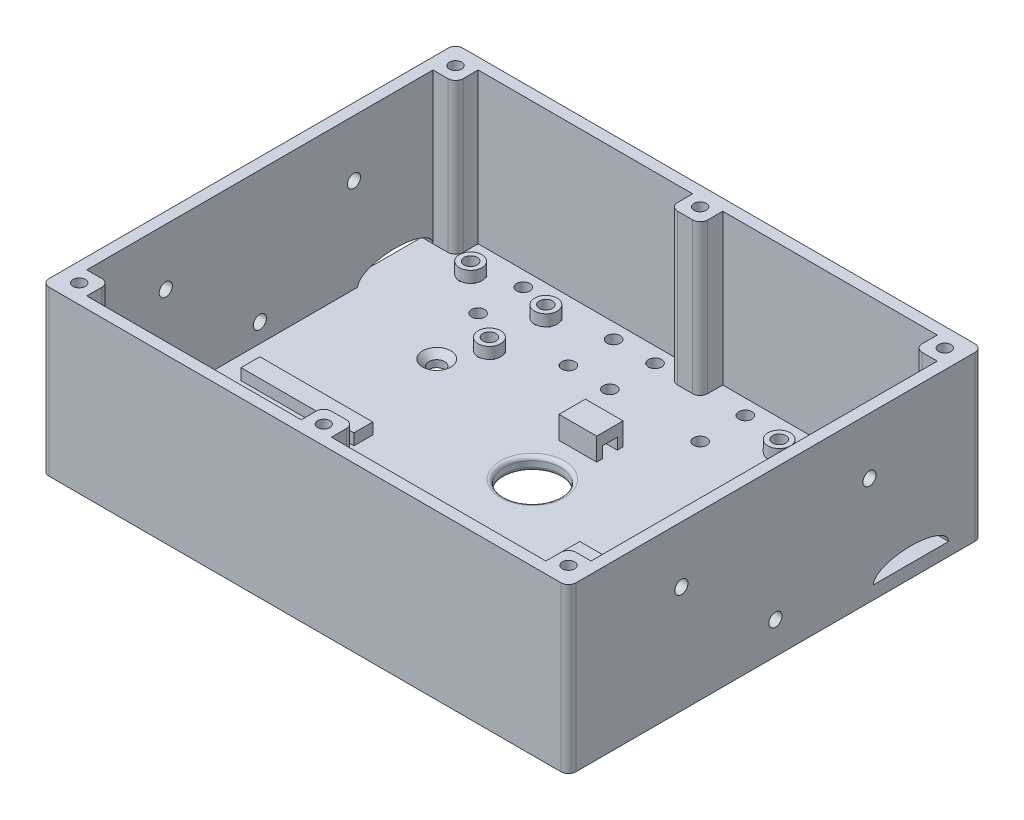
from build123d import *

# Parameters (mm, degrees)
SKETCH1_W                             = 140
SKETCH1_H                             = 110
BOTTOM_DEPTH                          = 3.5
SKETCH3_W                             = 140
SKETCH3_H                             = 110
WALL_DEPTH                            = 40
SKETCH4_R                             = 1.625
TOP_PLATE_SCREW_HOLES_DEPTH           = 30
TOP_PLATE_SCREW_HOLES_DRAFT           = -1
TOP_PLATE_SCREW_HOLES_PROFILE_2_DEPTH = 30
TOP_PLATE_SCREW_HOLES_PROFILE_2_DRAFT = -1
TOP_PLATE_SCREW_HOLES_PROFILE_3_DEPTH = 30
TOP_PLATE_SCREW_HOLES_PROFILE_3_DRAFT = -1
TOP_PLATE_SCREW_HOLES_PROFILE_4_DEPTH = 30
TOP_PLATE_SCREW_HOLES_PROFILE_4_DRAFT = -1
TOP_PLATE_SCREW_HOLES_PROFILE_5_DEPTH = 30
TOP_PLATE_SCREW_HOLES_PROFILE_5_DRAFT = -1
TOP_PLATE_SCREW_HOLES_PROFILE_6_DEPTH = 30
TOP_PLATE_SCREW_HOLES_PROFILE_6_DRAFT = -1
FILLET14_R                            = 2
FILLET13_R                            = 2
FILLET12_R                            = 2
FILLET11_R                            = 2
FILLET1_R                             = 2
FILLET2_R                             = 2
FILLET3_R                             = 2
FILLET4_R                             = 2
FILLET5_R                             = 2
FILLET6_R                             = 2
FILLET7_R                             = 2
FILLET8_R                             = 2
M4_MOUNT_R                            = 2.1
M4_MOUNT_CUT_DEPTH                    = 98.59610648
SKETCH7_R                             = 7.5
USB_CABEL_CUT_DEPTH                   = 100.082036717
FILLET9_R                             = 1
FILLET10_R                            = 1
SKETCH8_R                             = 1.75
UV_LAMP_M3_CUT_DEPTH                  = 10
M3_CONNECTION_R                       = 1.75
M3_CONNECTION_CUT_DEPTH               = 10
M3_CONNECTION_CUT_DIRECTION_2_REACH   = 155.903
CABLE_PASS_CUT_DEPTH                  = 10
CUT_EXTRUDE4_DEPTH                    = 10
SKETCH9_R                             = 3
SKETCH9_W                             = 30
SKETCH9_H                             = 5
CURCUIT_BOARD_MOUNT_POSTS_EXT_DEPTH   = 3
SKETCH10_R                            = 1.75
M3_SCREW_CURCUIT_MOUNT_CUT_DEPTH      = 97.405394151
M3_HEAD_CIRCUIT_MOUNT_CUT_DEPTH       = 3.5
SKETCH14_W                            = 10
SKETCH14_H                            = 7
BOSS_EXTRUDE1_DEPTH                   = 6
SKETCH16_W                            = 4
SKETCH16_H                            = 3
CUT_EXTRUDE6_DEPTH                    = 10


with BuildPart() as part:
    # Sketch1 → Bottom (new body)
    with BuildSketch(Plane(origin=(0, 0, 0), x_dir=(1, 0, 0), z_dir=(0, 1, 0))):
        Rectangle(SKETCH1_W, SKETCH1_H)
    extrude(amount=BOTTOM_DEPTH)

    # Sketch3 → Wall (add)
    with BuildSketch(Plane(origin=(0, 3.5, 0), x_dir=(1, 0, 0), z_dir=(0, 1, 0))):
        Rectangle(SKETCH3_W, SKETCH3_H)
        Polygon((-61, 52), (-4, 52), (-4, 46), (4, 46), (4, 52), (61, 52), (61, 46), (67, 46), (67, -46), (61, -46), (61, -52), (4, -52), (4, -46), (-4, -46), (-4, -52), (-61, -52), (-61, -46), (-67, -46), (-67, 46), (-61, 46), align=None, mode=Mode.SUBTRACT)
    extrude(amount=WALL_DEPTH)


with BuildPart() as top_plate_screw_holes_tool:
    # Sketch4 → Top Plate Screw Holes (with draft: the straight prism first)
    with BuildSketch(Plane(origin=(0, 43.5, 0), x_dir=(1, 0, 0), z_dir=(0, 1, 0))):
        with Locations((-65, 50)):
            Circle(SKETCH4_R)
    extrude(amount=-TOP_PLATE_SCREW_HOLES_DEPTH)
    # Top Plate Screw Holes: the draft: its side faces are tilted about the plane it starts from
    top_plate_screw_holes_sides = [top_plate_screw_holes_tool.faces().sort_by_distance(p)[0] for p in [
        (-66.625, 28.5, -50),
    ]]
    draft(top_plate_screw_holes_sides, Plane(origin=(0, 43.5, 0), x_dir=(1, 0, 0), z_dir=(0, 1, 0)), TOP_PLATE_SCREW_HOLES_DRAFT)


with BuildPart() as part_1:
    add(part.part)

    # Top Plate Screw Holes: cut by top_plate_screw_holes_tool
    add(top_plate_screw_holes_tool.part, mode=Mode.SUBTRACT)


with BuildPart() as top_plate_screw_holes_profile_2_tool:
    # Sketch4 → Top Plate Screw Holes profile 2 (with draft: the straight prism first)
    with BuildSketch(Plane(origin=(0, 43.5, 0), x_dir=(1, 0, 0), z_dir=(0, 1, 0))):
        with Locations((65, 50)):
            Circle(SKETCH4_R)
    extrude(amount=-TOP_PLATE_SCREW_HOLES_PROFILE_2_DEPTH)
    # Top Plate Screw Holes profile 2: the draft: its side faces are tilted about the plane it starts from
    top_plate_screw_holes_profile_2_sides = [top_plate_screw_holes_profile_2_tool.faces().sort_by_distance(p)[0] for p in [
        (63.375, 28.5, -50),
    ]]
    draft(top_plate_screw_holes_profile_2_sides, Plane(origin=(0, 43.5, 0), x_dir=(1, 0, 0), z_dir=(0, 1, 0)), TOP_PLATE_SCREW_HOLES_PROFILE_2_DRAFT)


with BuildPart() as part_2:
    add(part_1.part)

    # Top Plate Screw Holes profile 2: cut by top_plate_screw_holes_profile_2_tool
    add(top_plate_screw_holes_profile_2_tool.part, mode=Mode.SUBTRACT)


with BuildPart() as top_plate_screw_holes_profile_3_tool:
    # Sketch4 → Top Plate Screw Holes profile 3 (with draft: the straight prism first)
    with BuildSketch(Plane(origin=(0, 43.5, 0), x_dir=(1, 0, 0), z_dir=(0, 1, 0))):
        with Locations((65, -50)):
            Circle(SKETCH4_R)
    extrude(amount=-TOP_PLATE_SCREW_HOLES_PROFILE_3_DEPTH)
    # Top Plate Screw Holes profile 3: the draft: its side faces are tilted about the plane it starts from
    top_plate_screw_holes_profile_3_sides = [top_plate_screw_holes_profile_3_tool.faces().sort_by_distance(p)[0] for p in [
        (63.375, 28.5, 50),
    ]]
    draft(top_plate_screw_holes_profile_3_sides, Plane(origin=(0, 43.5, 0), x_dir=(1, 0, 0), z_dir=(0, 1, 0)), TOP_PLATE_SCREW_HOLES_PROFILE_3_DRAFT)


with BuildPart() as part_3:
    add(part_2.part)

    # Top Plate Screw Holes profile 3: cut by top_plate_screw_holes_profile_3_tool
    add(top_plate_screw_holes_profile_3_tool.part, mode=Mode.SUBTRACT)


with BuildPart() as top_plate_screw_holes_profile_4_tool:
    # Sketch4 → Top Plate Screw Holes profile 4 (with draft: the straight prism first)
    with BuildSketch(Plane(origin=(0, 43.5, 0), x_dir=(1, 0, 0), z_dir=(0, 1, 0))):
        with Locations((-65, -50)):
            Circle(SKETCH4_R)
    extrude(amount=-TOP_PLATE_SCREW_HOLES_PROFILE_4_DEPTH)
    # Top Plate Screw Holes profile 4: the draft: its side faces are tilted about the plane it starts from
    top_plate_screw_holes_profile_4_sides = [top_plate_screw_holes_profile_4_tool.faces().sort_by_distance(p)[0] for p in [
        (-66.625, 28.5, 50),
    ]]
    draft(top_plate_screw_holes_profile_4_sides, Plane(origin=(0, 43.5, 0), x_dir=(1, 0, 0), z_dir=(0, 1, 0)), TOP_PLATE_SCREW_HOLES_PROFILE_4_DRAFT)


with BuildPart() as part_4:
    add(part_3.part)

    # Top Plate Screw Holes profile 4: cut by top_plate_screw_holes_profile_4_tool
    add(top_plate_screw_holes_profile_4_tool.part, mode=Mode.SUBTRACT)


with BuildPart() as top_plate_screw_holes_profile_5_tool:
    # Sketch4 → Top Plate Screw Holes profile 5 (with draft: the straight prism first)
    with BuildSketch(Plane(origin=(0, 43.5, 0), x_dir=(1, 0, 0), z_dir=(0, 1, 0))):
        with Locations((0, 50)):
            Circle(SKETCH4_R)
    extrude(amount=-TOP_PLATE_SCREW_HOLES_PROFILE_5_DEPTH)
    # Top Plate Screw Holes profile 5: the draft: its side faces are tilted about the plane it starts from
    top_plate_screw_holes_profile_5_sides = [top_plate_screw_holes_profile_5_tool.faces().sort_by_distance(p)[0] for p in [
        (-1.625, 28.5, -50),
    ]]
    draft(top_plate_screw_holes_profile_5_sides, Plane(origin=(0, 43.5, 0), x_dir=(1, 0, 0), z_dir=(0, 1, 0)), TOP_PLATE_SCREW_HOLES_PROFILE_5_DRAFT)


with BuildPart() as part_5:
    add(part_4.part)

    # Top Plate Screw Holes profile 5: cut by top_plate_screw_holes_profile_5_tool
    add(top_plate_screw_holes_profile_5_tool.part, mode=Mode.SUBTRACT)


with BuildPart() as top_plate_screw_holes_profile_6_tool:
    # Sketch4 → Top Plate Screw Holes profile 6 (with draft: the straight prism first)
    with BuildSketch(Plane(origin=(0, 43.5, 0), x_dir=(1, 0, 0), z_dir=(0, 1, 0))):
        with Locations((0, -50)):
            Circle(SKETCH4_R)
    extrude(amount=-TOP_PLATE_SCREW_HOLES_PROFILE_6_DEPTH)
    # Top Plate Screw Holes profile 6: the draft: its side faces are tilted about the plane it starts from
    top_plate_screw_holes_profile_6_sides = [top_plate_screw_holes_profile_6_tool.faces().sort_by_distance(p)[0] for p in [
        (-1.625, 28.5, 50),
    ]]
    draft(top_plate_screw_holes_profile_6_sides, Plane(origin=(0, 43.5, 0), x_dir=(1, 0, 0), z_dir=(0, 1, 0)), TOP_PLATE_SCREW_HOLES_PROFILE_6_DRAFT)


with BuildPart() as part_6:
    add(part_5.part)

    # Top Plate Screw Holes profile 6: cut by top_plate_screw_holes_profile_6_tool
    add(top_plate_screw_holes_profile_6_tool.part, mode=Mode.SUBTRACT)

    # Fillet14
    fillet14_edges = [part_6.edges().sort_by_distance(p)[0] for p in [
        (-4, 23.5, 46),
    ]]
    fillet(fillet14_edges, radius=FILLET14_R)

    # Fillet13
    fillet13_edges = [part_6.edges().sort_by_distance(p)[0] for p in [
        (4, 23.5, 46),
    ]]
    fillet(fillet13_edges, radius=FILLET13_R)

    # Fillet12
    fillet12_edges = [part_6.edges().sort_by_distance(p)[0] for p in [
        (-4, 23.5, -46),
    ]]
    fillet(fillet12_edges, radius=FILLET12_R)

    # Fillet11
    fillet11_edges = [part_6.edges().sort_by_distance(p)[0] for p in [
        (4, 23.5, -46),
    ]]
    fillet(fillet11_edges, radius=FILLET11_R)

    # Fillet1
    fillet1_edges = [part_6.edges().sort_by_distance(p)[0] for p in [
        (-61, 23.5, 46),
    ]]
    fillet(fillet1_edges, radius=FILLET1_R)

    # Fillet2
    fillet2_edges = [part_6.edges().sort_by_distance(p)[0] for p in [
        (61, 23.5, 46),
    ]]
    fillet(fillet2_edges, radius=FILLET2_R)

    # Fillet3
    fillet3_edges = [part_6.edges().sort_by_distance(p)[0] for p in [
        (61, 23.5, -46),
    ]]
    fillet(fillet3_edges, radius=FILLET3_R)

    # Fillet4
    fillet4_edges = [part_6.edges().sort_by_distance(p)[0] for p in [
        (-61, 23.5, -46),
    ]]
    fillet(fillet4_edges, radius=FILLET4_R)

    # Fillet5
    fillet5_edges = [part_6.edges().sort_by_distance(p)[0] for p in [
        (-70, 21.75, -55),
    ]]
    fillet(fillet5_edges, radius=FILLET5_R)

    # Fillet6
    fillet6_edges = [part_6.edges().sort_by_distance(p)[0] for p in [
        (70, 21.75, -55),
    ]]
    fillet(fillet6_edges, radius=FILLET6_R)

    # Fillet7
    fillet7_edges = [part_6.edges().sort_by_distance(p)[0] for p in [
        (70, 21.75, 55),
    ]]
    fillet(fillet7_edges, radius=FILLET7_R)

    # Fillet8
    fillet8_edges = [part_6.edges().sort_by_distance(p)[0] for p in [
        (-70, 21.75, 55),
    ]]
    fillet(fillet8_edges, radius=FILLET8_R)

    # M4 Mount → M4 Mount Cut (cut, through all)
    with BuildSketch(Plane.XZ.offset(-3.5)):
        with Locations(Location((40, -20, 0), (0, 0, 270))):
            Circle(M4_MOUNT_R)
        with Locations(Location((40, 20, 0), (0, 0, 270))):
            Circle(M4_MOUNT_R)
        with Locations(Location((-40, 20, 0), (0, 0, 90))):
            Circle(M4_MOUNT_R)
        with Locations(Location((-40, -20, 0), (0, 0, 90))):
            Circle(M4_MOUNT_R)
    extrude(amount=M4_MOUNT_CUT_DEPTH, mode=Mode.SUBTRACT)

    # Cut-Extrude3 cone 1 section (through the dimple's axis) → Cut-Extrude3 (revolve, cut)
    with BuildSketch(Plane(origin=(40, 3.5, 20), x_dir=(0, 0, 1), z_dir=(1, 0, 0))):
        Polygon((0, 0), (3.75, 0), (0, 3.75), align=None)
    revolve(axis=Axis((40, 3.5, 20), (0, -1, 0)), mode=Mode.SUBTRACT)

    # Cut-Extrude3 cone 2 section (through the dimple's axis) → Cut-Extrude3 cone 2 (revolve, cut)
    with BuildSketch(Plane(origin=(40, 3.5, -20), x_dir=(0, 0, 1), z_dir=(1, 0, 0))):
        Polygon((0, 0), (3.75, 0), (0, 3.75), align=None)
    revolve(axis=Axis((40, 3.5, -20), (0, -1, 0)), mode=Mode.SUBTRACT)

    # Cut-Extrude3 cone 3 section (through the dimple's axis) → Cut-Extrude3 cone 3 (revolve, cut)
    with BuildSketch(Plane(origin=(-40, 3.5, -20), x_dir=(0, 0, 1), z_dir=(1, 0, 0))):
        Polygon((0, 0), (3.75, 0), (0, 3.75), align=None)
    revolve(axis=Axis((-40, 3.5, -20), (0, -1, 0)), mode=Mode.SUBTRACT)

    # Cut-Extrude3 cone 4 section (through the dimple's axis) → Cut-Extrude3 cone 4 (revolve, cut)
    with BuildSketch(Plane(origin=(-40, 3.5, 20), x_dir=(0, 0, 1), z_dir=(1, 0, 0))):
        Polygon((0, 0), (3.75, 0), (0, 3.75), align=None)
    revolve(axis=Axis((-40, 3.5, 20), (0, -1, 0)), mode=Mode.SUBTRACT)

    # Sketch7 → USB Cabel Cut (cut, through all)
    with BuildSketch(Plane.XZ):
        with Locations(Location((0.418373374, -5, 0), (0, 0, 270))):
            Circle(SKETCH7_R)
    extrude(amount=-USB_CABEL_CUT_DEPTH, mode=Mode.SUBTRACT)

    # Fillet9
    fillet9_edges = [part_6.edges().sort_by_distance(p)[0] for p in [
        (0.418373374, 0, 2.5),
    ]]
    fillet(fillet9_edges, radius=FILLET9_R)

    # Fillet10
    fillet10_edges = [part_6.edges().sort_by_distance(p)[0] for p in [
        (0.418373374, 3.5, 2.5),
    ]]
    fillet(fillet10_edges, radius=FILLET10_R)

    # Sketch8 → UV LAMP M3 CUT (cut)
    with BuildSketch(Plane(origin=(0, 3.5, 0), x_dir=(1, 0, 0), z_dir=(0, 1, 0))):
        with Locations(Location((-10, 48, 0), (0, 0, 270))):
            Circle(SKETCH8_R)
        with Locations(Location((-10, 36, 0), (0, 0, 270))):
            Circle(SKETCH8_R)
        with Locations(Location((14, 48, 0), (0, 0, 270))):
            Circle(SKETCH8_R)
        with Locations(Location((14, 36, 0), (0, 0, 270))):
            Circle(SKETCH8_R)
        with Locations(Location((-45, 48, 0), (0, 0, 270))):
            Circle(SKETCH8_R)
        with Locations(Location((-45, 36, 0), (0, 0, 270))):
            Circle(SKETCH8_R)
        with Locations(Location((-21, 48, 0), (0, 0, 270))):
            Circle(SKETCH8_R)
        with Locations(Location((-21, 36, 0), (0, 0, 270))):
            Circle(SKETCH8_R)
    extrude(amount=-UV_LAMP_M3_CUT_DEPTH, mode=Mode.SUBTRACT)

    # M3 Connection → M3 Connection CUT (cut)
    with BuildSketch(Plane(origin=(-67, 0, 0), x_dir=(0, 0, -1), z_dir=(1, 0, 0))):
        with Locations(Location((25, 28.5, 0), (0, 0, 180))):
            Circle(M3_CONNECTION_R)
        with Locations(Location((0, 8.5, 0), (0, 0, 180))):
            Circle(M3_CONNECTION_R)
        with Locations(Location((-25, 28.5, 0), (0, 0, 180))):
            Circle(M3_CONNECTION_R)
    extrude(amount=-M3_CONNECTION_CUT_DEPTH, mode=Mode.SUBTRACT)

    # M3 Connection CUT direction 2: up to this face of the body (flat: up to its plane)
    m3_connection_cut_direction_2_end = Plane(part_6.part.faces().sort_by_distance((70, 21.75, 0))[0])
    # M3 Connection → M3 Connection CUT direction 2 (cut, up to the picked face)
    with BuildSketch(Plane(origin=(-67, 0, 0), x_dir=(0, 0, -1), z_dir=(1, 0, 0)), mode=Mode.PRIVATE) as m3_connection_cut_direction_2_sk1:
        with Locations(Location((25, 28.5, 0), (0, 0, 180))):
            Circle(M3_CONNECTION_R)
    m3_connection_cut_direction_2_tool1 = split(extrude(m3_connection_cut_direction_2_sk1.sketch, amount=M3_CONNECTION_CUT_DIRECTION_2_REACH, mode=Mode.PRIVATE), bisect_by=m3_connection_cut_direction_2_end, keep=Keep.BOTH, mode=Mode.PRIVATE)
    # M3 Connection → M3 Connection CUT direction 2 (cut, up to the picked face)
    with BuildSketch(Plane(origin=(-67, 0, 0), x_dir=(0, 0, -1), z_dir=(1, 0, 0)), mode=Mode.PRIVATE) as m3_connection_cut_direction_2_sk2:
        with Locations(Location((0, 8.5, 0), (0, 0, 180))):
            Circle(M3_CONNECTION_R)
    m3_connection_cut_direction_2_tool2 = split(extrude(m3_connection_cut_direction_2_sk2.sketch, amount=M3_CONNECTION_CUT_DIRECTION_2_REACH, mode=Mode.PRIVATE), bisect_by=m3_connection_cut_direction_2_end, keep=Keep.BOTH, mode=Mode.PRIVATE)
    # M3 Connection → M3 Connection CUT direction 2 (cut, up to the picked face)
    with BuildSketch(Plane(origin=(-67, 0, 0), x_dir=(0, 0, -1), z_dir=(1, 0, 0)), mode=Mode.PRIVATE) as m3_connection_cut_direction_2_sk3:
        with Locations(Location((-25, 28.5, 0), (0, 0, 180))):
            Circle(M3_CONNECTION_R)
    m3_connection_cut_direction_2_tool3 = split(extrude(m3_connection_cut_direction_2_sk3.sketch, amount=M3_CONNECTION_CUT_DIRECTION_2_REACH, mode=Mode.PRIVATE), bisect_by=m3_connection_cut_direction_2_end, keep=Keep.BOTH, mode=Mode.PRIVATE)
    add(m3_connection_cut_direction_2_tool1.solids().sort_by(Axis((-67, 28.5, -25), (1, 0, 0)))[0], mode=Mode.SUBTRACT)
    add(m3_connection_cut_direction_2_tool2.solids().sort_by(Axis((-67, 8.5, 0), (1, 0, 0)))[0], mode=Mode.SUBTRACT)
    add(m3_connection_cut_direction_2_tool3.solids().sort_by(Axis((-67, 28.5, 25), (1, 0, 0)))[0], mode=Mode.SUBTRACT)

    # Cable Pass → Cable Pass CUT (cut)
    with BuildSketch(Plane(origin=(-67, 0, 0), x_dir=(0, 0, -1), z_dir=(1, 0, 0))):
        with BuildLine():
            Line((46, 3.5), (26, 3.5))
            add(Edge.make_bspline(
                [(46, 3.5), (46, 7.5), (36, 7.5), (26, 7.5), (26, 3.5)],
                knots=[0, 0, 0, 1.570796327, 1.570796327, 3.141592654, 3.141592654, 3.141592654], degree=2, weights=[1, 0.707106781, 1, 0.707106781, 1]))
        make_face()
    extrude(amount=-CABLE_PASS_CUT_DEPTH, mode=Mode.SUBTRACT)

    # Sketch12 → Cut-Extrude4 (cut)
    with BuildSketch(Plane.ZY.offset(-67)):
        with BuildLine():
            Line((-26, 3.5), (-46, 3.5))
            add(Edge.make_bspline(
                [(-26, 3.5), (-26, 7.5), (-36, 7.5), (-46, 7.5), (-46, 3.5)],
                knots=[0, 0, 0, 1.570796327, 1.570796327, 3.141592654, 3.141592654, 3.141592654], degree=2, weights=[1, 0.707106781, 1, 0.707106781, 1]))
        make_face()
    extrude(amount=-CUT_EXTRUDE4_DEPTH, mode=Mode.SUBTRACT)

    # Sketch9 → Curcuit Board Mount Posts EXT (add)
    with BuildSketch(Plane(origin=(0, 3.5, 0), x_dir=(1, 0, 0), z_dir=(0, 1, 0))):
        with Locations(Location((47, 44, 0), (0, 0, 270))):
            Circle(SKETCH9_R)
        with Locations(Location((27, 44, 0), (0, 0, 270))):
            Circle(SKETCH9_R)
        with Locations(Location((47, 29, 0), (0, 0, 270))):
            Circle(SKETCH9_R)
        with Locations(Location((-35, 44, 0), (0, 0, 270))):
            Circle(SKETCH9_R)
        with Locations(Location((-35, 29, 0), (0, 0, 270))):
            Circle(SKETCH9_R)
        with Locations(Location((-55, 44, 0), (0, 0, 270))):
            Circle(SKETCH9_R)
        with Locations((-46, -8.5)):
            Rectangle(SKETCH9_W, SKETCH9_H)
        with Locations((39, -8.5)):
            Rectangle(SKETCH9_W, SKETCH9_H)
    extrude(amount=CURCUIT_BOARD_MOUNT_POSTS_EXT_DEPTH)

    # Sketch10 → M3 Screw Curcuit Mount CUT (cut, through all)
    with BuildSketch(Plane(origin=(0, 6.5, 0), x_dir=(1, 0, 0), z_dir=(0, 1, 0))):
        with Locations(Location((-55, 44, 0), (0, 0, 270))):
            Circle(SKETCH10_R)
        with Locations(Location((-35, 44, 0), (0, 0, 270))):
            Circle(SKETCH10_R)
        with Locations(Location((-35, 29, 0), (0, 0, 270))):
            Circle(SKETCH10_R)
        with Locations(Location((27, 44, 0), (0, 0, 270))):
            Circle(SKETCH10_R)
        with Locations(Location((47, 44, 0), (0, 0, 270))):
            Circle(SKETCH10_R)
        with Locations(Location((47, 29, 0), (0, 0, 270))):
            Circle(SKETCH10_R)
    extrude(amount=-M3_SCREW_CURCUIT_MOUNT_CUT_DEPTH, mode=Mode.SUBTRACT)

    # Sketch11 → M3 Head Circuit Mount CUT (cut)
    with BuildSketch(Plane.XZ):
        Polygon((-35, -47.175426481), (-32.25, -45.58771324), (-32.25, -42.41228676), (-35, -40.824573519), (-37.75, -42.41228676), (-37.75, -45.58771324), align=None)
        Polygon((-55, -47.175426481), (-52.25, -45.58771324), (-52.25, -42.41228676), (-55, -40.824573519), (-57.75, -42.41228676), (-57.75, -45.58771324), align=None)
        Polygon((-35, -32.175426481), (-32.25, -30.58771324), (-32.25, -27.41228676), (-35, -25.824573519), (-37.75, -27.41228676), (-37.75, -30.58771324), align=None)
        Polygon((27, -47.175426481), (29.75, -45.58771324), (29.75, -42.41228676), (27, -40.824573519), (24.25, -42.41228676), (24.25, -45.58771324), align=None)
        Polygon((47, -47.175426481), (49.75, -45.58771324), (49.75, -42.41228676), (47, -40.824573519), (44.25, -42.41228676), (44.25, -45.58771324), align=None)
        Polygon((47, -32.175426481), (49.75, -30.58771324), (49.75, -27.41228676), (47, -25.824573519), (44.25, -27.41228676), (44.25, -30.58771324), align=None)
    extrude(amount=-M3_HEAD_CIRCUIT_MOUNT_CUT_DEPTH, mode=Mode.SUBTRACT)

    # Sketch14 → Boss-Extrude1 (add)
    with BuildSketch(Plane(origin=(0, 3.5, 0), x_dir=(1, 0, 0), z_dir=(0, 1, 0))):
        with Locations((0, 21)):
            Rectangle(SKETCH14_W, SKETCH14_H)
    extrude(amount=BOSS_EXTRUDE1_DEPTH)

    # Sketch16 → Cut-Extrude6 (cut)
    with BuildSketch(Plane.ZY.offset(5)):
        with Locations((-21, 5)):
            Rectangle(SKETCH16_W, SKETCH16_H)
    extrude(amount=-CUT_EXTRUDE6_DEPTH, mode=Mode.SUBTRACT)


solid = part_6.part
